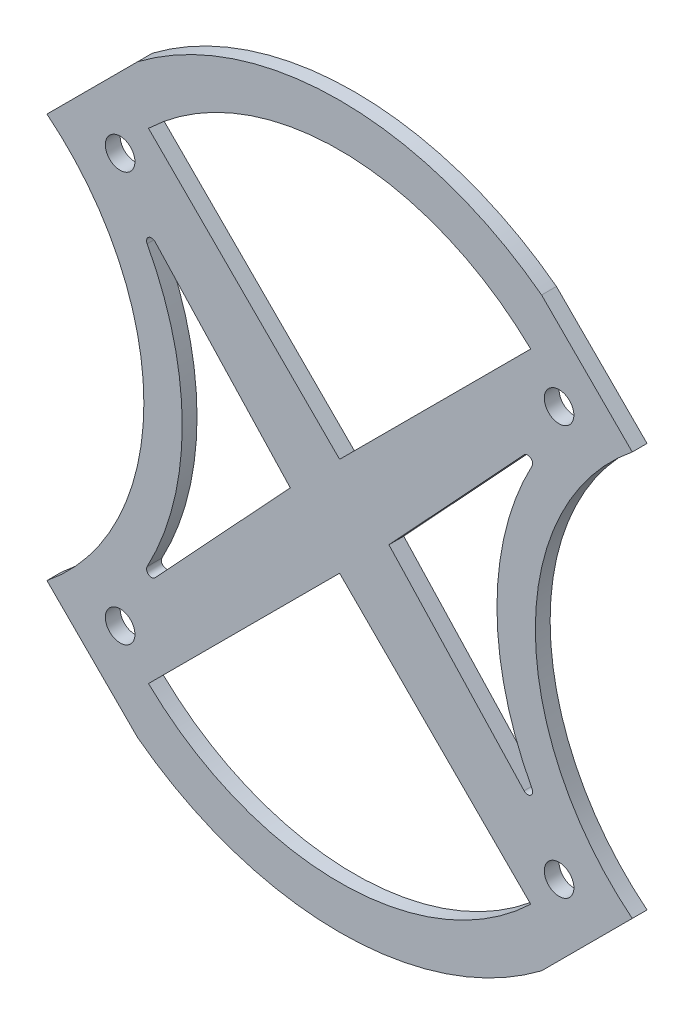
from build123d import *

# Parameters (mm, degrees)
SKETCH1_R             = 5
BOSS_EXTRUDE1_DEPTH   = 0.1
BOSS_EXTRUDE1_2_DEPTH = 0.1
BOSS_EXTRUDE1_3_DEPTH = 0.1
BOSS_EXTRUDE1_4_DEPTH = 0.1
BOSS_EXTRUDE2_DEPTH   = 3
SKETCH3_R             = 3
CUT_EXTRUDE1_DEPTH    = 3


with BuildPart() as part:
    # Sketch1 → Boss-Extrude1 (new body)
    with BuildSketch(Plane.XY):
        with Locations((-44.491847198, 44.491847198)):
            Circle(SKETCH1_R)
    extrude(amount=BOSS_EXTRUDE1_DEPTH)



with BuildPart() as body_2:
    # Sketch1 → Boss-Extrude1 2 (new body)
    with BuildSketch(Plane.XY):
        with Locations((44.491847198, 44.491847198)):
            Circle(SKETCH1_R)
    extrude(amount=BOSS_EXTRUDE1_2_DEPTH)


with BuildPart() as body_3:
    # Sketch1 → Boss-Extrude1 3 (new body)
    with BuildSketch(Plane.XY):
        with Locations((44.491847198, -44.491847198)):
            Circle(SKETCH1_R)
    extrude(amount=BOSS_EXTRUDE1_3_DEPTH)


with BuildPart() as body_4:
    # Sketch1 → Boss-Extrude1 4 (new body)
    with BuildSketch(Plane.XY):
        with Locations((-44.491847198, -44.491847198)):
            Circle(SKETCH1_R)
    extrude(amount=BOSS_EXTRUDE1_4_DEPTH)


with BuildPart() as part_1:
    add(part.part)

    add(body_2.part)  # Boss-Extrude2 merges body 2

    add(body_3.part)  # Boss-Extrude2 merges body 3

    add(body_4.part)  # Boss-Extrude2 merges body 4
    # Sketch2 → Boss-Extrude2 (add)
    with BuildSketch(Plane.XY):
        with BuildLine():
            Line((-59.341089603, 40.956313292), (-40.956313292, 59.341089603))
            ThreePointArc((-40.956313292, 59.341089603), (0, 73.058676231), (40.956313292, 59.341089603))
            Line((40.956313292, 59.341089603), (59.341089603, 40.956313292))
            ThreePointArc((59.341089603, 40.956313292), (39.686643359, 0), (59.341089603, -40.956313292))
            Line((59.341089603, -40.956313292), (40.956313292, -59.341089603))
            ThreePointArc((40.956313292, -59.341089603), (0, -73.058676231), (-40.956313292, -59.341089603))
            Line((-40.956313292, -59.341089603), (-59.341089603, -40.956313292))
            ThreePointArc((-59.341089603, -40.956313292), (-39.686643359, 0), (-59.341089603, 40.956313292))
        make_face()
        with BuildLine():
            Line((-38.750824491, 48.750824491), (0, 10))
            Line((0, 10), (38.750824491, 48.750824491))
            ThreePointArc((38.750824491, 48.750824491), (0, 64.323437718), (-38.750824491, 48.750824491))
        make_face(mode=Mode.SUBTRACT)
        with BuildLine():
            Line((-37.410135101, 29.495739933), (-10, 0))
            Line((-10, 0), (-37.410135101, -29.495739933))
            ThreePointArc((-37.410135101, -29.495739933), (-38.724006049, -29.628666123), (-39.024062115, -28.342628566))
            ThreePointArc((-39.024062115, -28.342628566), (-31.907853639, 0), (-39.024062115, 28.342628566))
            ThreePointArc((-39.024062115, 28.342628566), (-38.724006049, 29.628666123), (-37.410135101, 29.495739933))
        make_face(mode=Mode.SUBTRACT)
        with BuildLine():
            Line((10, 0), (37.410135101, -29.495739933))
            ThreePointArc((37.410135101, -29.495739933), (38.724006049, -29.628666123), (39.024062115, -28.342628566))
            ThreePointArc((39.024062115, -28.342628566), (31.907853639, 0), (39.024062115, 28.342628566))
            ThreePointArc((39.024062115, 28.342628566), (38.724006049, 29.628666123), (37.410135101, 29.495739933))
            Line((37.410135101, 29.495739933), (10, 0))
        make_face(mode=Mode.SUBTRACT)
        with BuildLine():
            Line((0, -10), (38.750824491, -48.750824491))
            ThreePointArc((38.750824491, -48.750824491), (0, -64.323437718), (-38.750824491, -48.750824491))
            Line((-38.750824491, -48.750824491), (0, -10))
        make_face(mode=Mode.SUBTRACT)
    extrude(amount=BOSS_EXTRUDE2_DEPTH)

    # Sketch3 → Cut-Extrude1 (cut)
    with BuildSketch(Plane.XY.offset(3)):
        with Locations((-44.5, -41.5)):
            Circle(SKETCH3_R)
        with Locations((44.5, -41.5)):
            Circle(SKETCH3_R)
        with Locations((44.5, 41.5)):
            Circle(SKETCH3_R)
        with Locations((-44.5, 41.5)):
            Circle(SKETCH3_R)
    extrude(amount=-CUT_EXTRUDE1_DEPTH, mode=Mode.SUBTRACT)


solid = part_1.part
